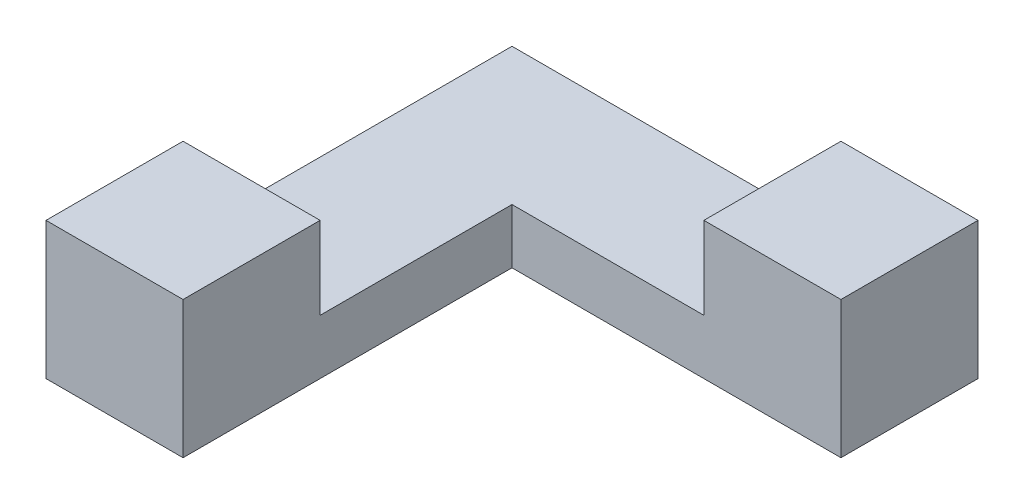
from build123d import *

# Parameters (mm, degrees)
BOSS_EXTRUDE1_DEPTH = 2
SKETCH2_W           = 5
SKETCH2_H           = 5
BOSS_EXTRUDE2_DEPTH = 5


with BuildPart() as part:
    # Sketch1 → Boss-Extrude1 (new body)
    with BuildSketch(Plane(origin=(0, 0, 0), x_dir=(1, 0, 0), z_dir=(0, 1, 0))):
        Polygon((0, 0), (0, 7), (7, 7), (7, 12), (-5, 12), (-5, 0), align=None)
    extrude(amount=BOSS_EXTRUDE1_DEPTH)

    # Sketch2 → Boss-Extrude2 (add)
    with BuildSketch(Plane.XZ):
        with Locations((-2.5, 2.5)):
            Rectangle(SKETCH2_W, SKETCH2_H)
        with Locations((9.5, -9.5)):
            Rectangle(SKETCH2_W, SKETCH2_H)
    extrude(amount=-BOSS_EXTRUDE2_DEPTH)


solid = part.part
